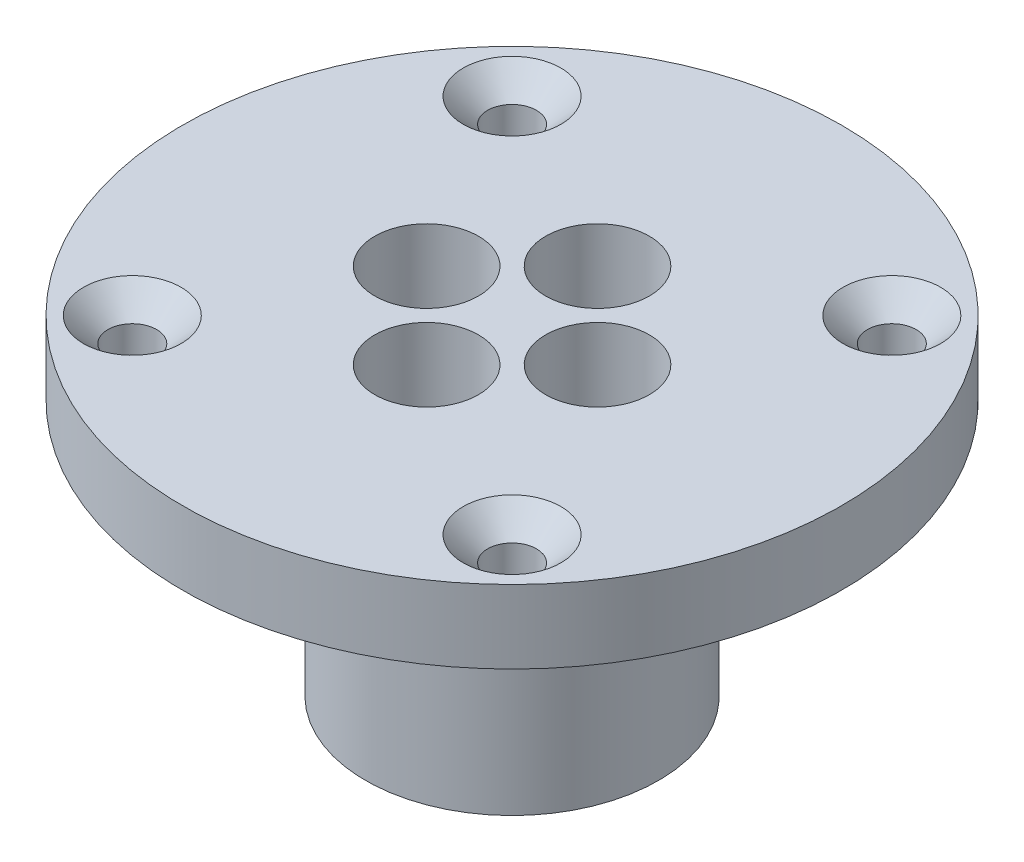
from build123d import *

# Parameters (mm, degrees)
ESBO_O2_R                = 1.75
CORTE_EXTRUS_O1_DEPTH    = 6
ESBO_O3_R                = 4.25
CORTE_EXTRUS_O2_DEPTH    = 43.649736224
PADR_OCIRCULAR1_COUNT    = 4
CHANFRO1_SIZE            = 2
ESBO_O4_R                = 2
CORTE_EXTRUS_O3_DEPTH    = 46.639894829
PADR_OCIRCULAR2_COUNT    = 4
CHANFRO3_SIZE            = 2
RESSALTO_EXTRUS_O2_START = 2
ESBO_O5_R                = 12
ESBO_O5_R_2              = 1.75
RESSALTO_EXTRUS_O2_DEPTH = 2


with BuildPart() as part:
    # Esboço1 → Revolução1 (revolve)
    with BuildSketch(Plane.XY, mode=Mode.PRIVATE) as revolu_o1_sk:
        Polygon((0, 0), (0, 25), (27, 25), (27, 19), (12, 19), (12, 0), align=None)
    revolve(revolu_o1_sk.sketch.rotate(Axis((0, 0, 0), (0, 1, 0)), 90), axis=Axis((0, 0, 0), (0, 1, 0)))

    # Esboço2 → Corte-extrusão1 (cut)
    with BuildSketch(Plane.XZ):
        with Locations(Location((0, 7, 0), (0, 0, 270))):
            Circle(ESBO_O2_R)
    corte_extrus_o1 = extrude(amount=-CORTE_EXTRUS_O1_DEPTH, mode=Mode.SUBTRACT)

    # Esboço3 → Corte-extrusão2 (cut, through all)
    with BuildSketch(Plane.XZ.offset(-6)):
        with Locations(Location((0, 7, 0), (0, 0, 270))):
            Circle(ESBO_O3_R)
    corte_extrus_o2 = extrude(amount=-CORTE_EXTRUS_O2_DEPTH, mode=Mode.SUBTRACT)

    # PadrãoCircular1: Corte-extrusão1, Corte-extrusão2 ×4 about axis
    padr_ocircular1_axis = Axis((0, 0, 0), (0, 1, 0))
    add([corte_extrus_o1.rotate(padr_ocircular1_axis, i * 360 / PADR_OCIRCULAR1_COUNT) for i in range(1, PADR_OCIRCULAR1_COUNT)], mode=Mode.SUBTRACT)
    add([corte_extrus_o2.rotate(padr_ocircular1_axis, i * 360 / PADR_OCIRCULAR1_COUNT) for i in range(1, PADR_OCIRCULAR1_COUNT)], mode=Mode.SUBTRACT)

    # Chanfro1
    chanfro1_edges = [part.edges().sort_by_distance(p)[0] for p in [
        (0, 6, 8.75),
        (0, 6, -8.75),
        (8.75, 6, 0),
        (-8.75, 6, 0),
    ]]
    chamfer(chanfro1_edges, length=CHANFRO1_SIZE)

    # Esboço4 → Corte-extrusão3 (cut, through all)
    with BuildSketch(Plane(origin=(0, 25, 0), x_dir=(1, 0, 0), z_dir=(0, 1, 0))):
        with Locations(Location((-15.556349186, 15.556349186, 0), (0, 0, 270))):
            Circle(ESBO_O4_R)
    corte_extrus_o3 = extrude(amount=-CORTE_EXTRUS_O3_DEPTH, mode=Mode.SUBTRACT)

    # PadrãoCircular2: Corte-extrusão3 ×4 about axis
    padr_ocircular2_axis = Axis((0, 0, 0), (0, 1, 0))
    for i in range(1, PADR_OCIRCULAR2_COUNT):
        add(corte_extrus_o3.rotate(padr_ocircular2_axis, i * 360 / PADR_OCIRCULAR2_COUNT), mode=Mode.SUBTRACT)

    # Chanfro3
    chanfro3_edges = [part.edges().sort_by_distance(p)[0] for p in [
        (-15.556349186, 25, -17.556349186),
        (17.556349186, 25, -15.556349186),
        (15.556349186, 25, 17.556349186),
        (-17.556349186, 25, 15.556349186),
    ]]
    chamfer(chanfro3_edges, length=CHANFRO3_SIZE)

    # Esboço5 → Ressalto-extrusão2 (add)
    with BuildSketch(Plane.XZ.offset(RESSALTO_EXTRUS_O2_START)):
        with Locations(Location((0, 0, 0), (0, 0, 270))):
            Circle(ESBO_O5_R)
        with Locations(Location((-7, 0, 0), (0, 0, 270))):
            Circle(ESBO_O5_R_2, mode=Mode.SUBTRACT)
        with Locations(Location((0, -7, 0), (0, 0, 270))):
            Circle(ESBO_O5_R_2, mode=Mode.SUBTRACT)
        with Locations(Location((7, 0, 0), (0, 0, 270))):
            Circle(ESBO_O5_R_2, mode=Mode.SUBTRACT)
        with Locations(Location((0, 7, 0), (0, 0, 270))):
            Circle(ESBO_O5_R_2, mode=Mode.SUBTRACT)
    extrude(amount=-RESSALTO_EXTRUS_O2_DEPTH)


solid = part.part
